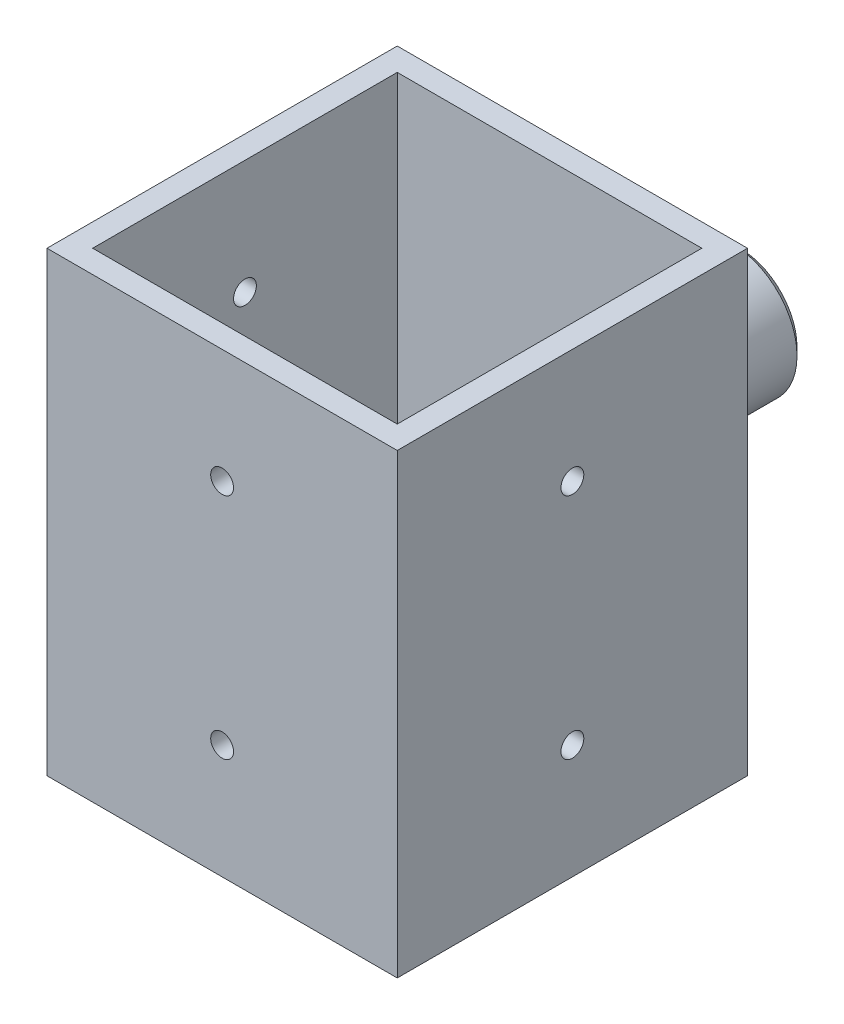
from build123d import *

# Parameters (mm, degrees)
ESQUISSE1_R                  = 8.5
BOSS_EXTRU_1_DEPTH           = 10
ESQUISSE2_R                  = 11
BOSS_EXTRU_2_DEPTH           = 12
ESQUISSE3_R                  = 2
ENL_V_MAT_EXTRU_1_DEPTH      = 8
CHANFREIN1_SIZE              = 1
BOSS_EXTRU_3_DEPTH           = 30
BOSS_EXTRU_3_DEPTH_BACK      = 30
ESQUISSE4_W                  = 46
ESQUISSE4_H                  = 46
ESQUISSE4_W_2                = 40
ESQUISSE4_H_2                = 40
ENL_V_MAT_EXTRU_2_DEPTH      = 88.407093534
ENL_V_MAT_EXTRU_2_DEPTH_BACK = 88.407093534
ESQUISSE5_R                  = 1.5
ESQUISSE6_R                  = 1.5
ENL_V_MAT_EXTRU_3_DEPTH      = 10
CONG_1_R                     = 10


with BuildPart() as part:
    # Esquisse1 → Boss.-Extru.1 (new body)
    with BuildSketch(Plane.XY):
        Circle(ESQUISSE1_R)
    extrude(amount=BOSS_EXTRU_1_DEPTH)

    # Esquisse2 → Boss.-Extru.2 (add)
    with BuildSketch(Plane.XY.offset(10)):
        Circle(ESQUISSE2_R)
    extrude(amount=BOSS_EXTRU_2_DEPTH)

    # Esquisse3 → Enlèv. mat.-Extru.1 (cut)
    with BuildSketch(Plane(origin=(0, 0, 0), x_dir=(-1, 0, 0), z_dir=(0, 0, -1))):
        with Locations((0, 4.9)):
            Circle(ESQUISSE3_R)
        with Locations((4.243524479, -2.45)):
            Circle(ESQUISSE3_R)
        with Locations((-4.243524479, -2.45)):
            Circle(ESQUISSE3_R)
    extrude(amount=-ENL_V_MAT_EXTRU_1_DEPTH, mode=Mode.SUBTRACT)

    # Chanfrein1
    chanfrein1_edges = [part.edges().sort_by_distance(p)[0] for p in [
        (-8.5, 0, 0),
    ]]
    chamfer(chanfrein1_edges, length=CHANFREIN1_SIZE)

    # Esquisse4 → Boss.-Extru.3 (add, two sides: drawn at the far end of the back side and taken through both)
    with BuildSketch(Plane(origin=(0, 0, 0), x_dir=(1, 0, 0), z_dir=(0, 1, 0)).offset(-BOSS_EXTRU_3_DEPTH_BACK)):
        with Locations((0, -45)):
            Rectangle(ESQUISSE4_W, ESQUISSE4_H)
        with Locations((0, -45)):
            Rectangle(ESQUISSE4_W_2, ESQUISSE4_H_2, mode=Mode.SUBTRACT)
    extrude(amount=BOSS_EXTRU_3_DEPTH + BOSS_EXTRU_3_DEPTH_BACK)

    # Esquisse5 → Enlèv. mat.-Extru.2 (cut, two sides: drawn at the far end of the back side and taken through both)
    with BuildSketch(Plane(origin=(23, 0, 0), x_dir=(0, 0, -1), z_dir=(1, 0, 0)).offset(-ENL_V_MAT_EXTRU_2_DEPTH_BACK)):
        with Locations((-45, 15)):
            Circle(ESQUISSE5_R)
        with Locations((-45, -15)):
            Circle(ESQUISSE5_R)
    extrude(amount=ENL_V_MAT_EXTRU_2_DEPTH + ENL_V_MAT_EXTRU_2_DEPTH_BACK, mode=Mode.SUBTRACT)

    # Esquisse6 → Enlèv. mat.-Extru.3 (cut)
    with BuildSketch(Plane.XY.offset(68)):
        with Locations((0, 15)):
            Circle(ESQUISSE6_R)
        with Locations((0, -15)):
            Circle(ESQUISSE6_R)
    extrude(amount=-ENL_V_MAT_EXTRU_3_DEPTH, mode=Mode.SUBTRACT)

    # Congé1
    cong_1_edges = [part.edges().sort_by_distance(p)[0] for p in [
        (-11, 0, 22),
    ]]
    fillet(cong_1_edges, radius=CONG_1_R)


solid = part.part
